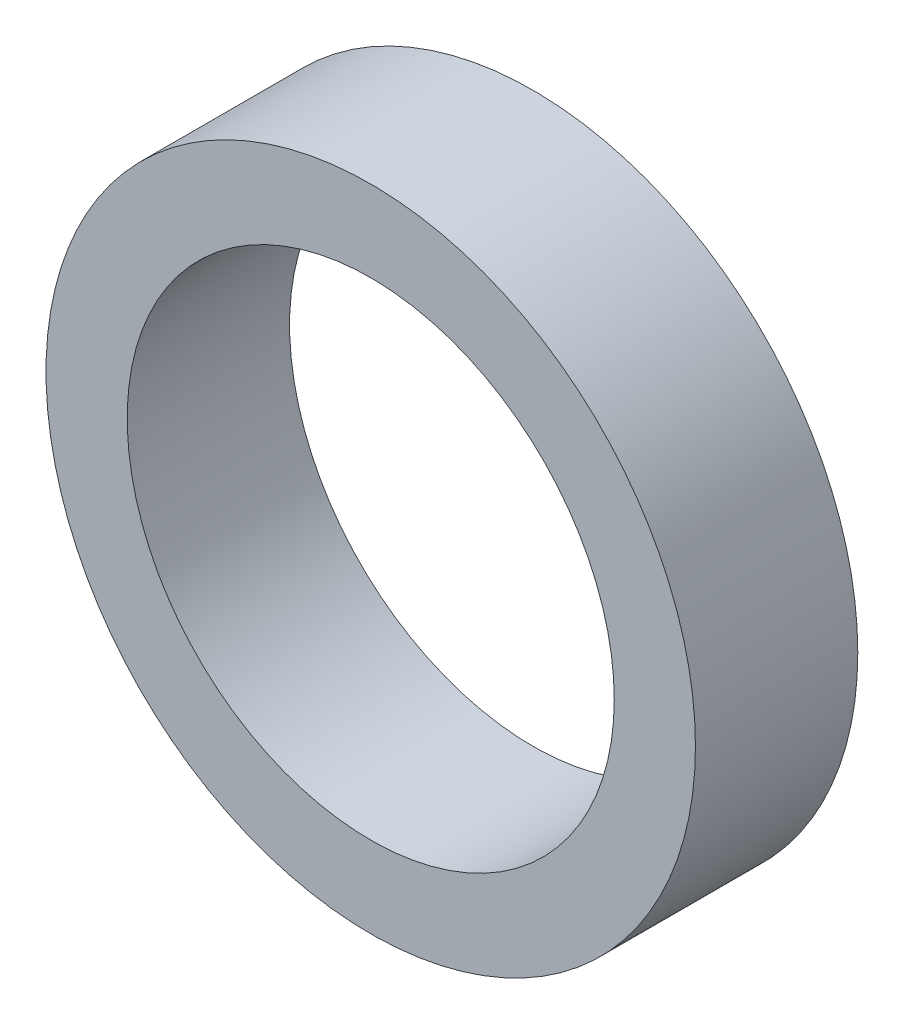
from build123d import *

# Parameters (mm, degrees)
SKETCH_1_R      = 4
SKETCH_1_R_2    = 3
EXTRUDE_1_DEPTH = 2


with BuildPart() as part:
    # 草图1 → 凸台-拉伸1 (new body)
    with BuildSketch(Plane.XY):
        Circle(SKETCH_1_R)
        Circle(SKETCH_1_R_2, mode=Mode.SUBTRACT)
    extrude(amount=EXTRUDE_1_DEPTH)


solid = part.part
